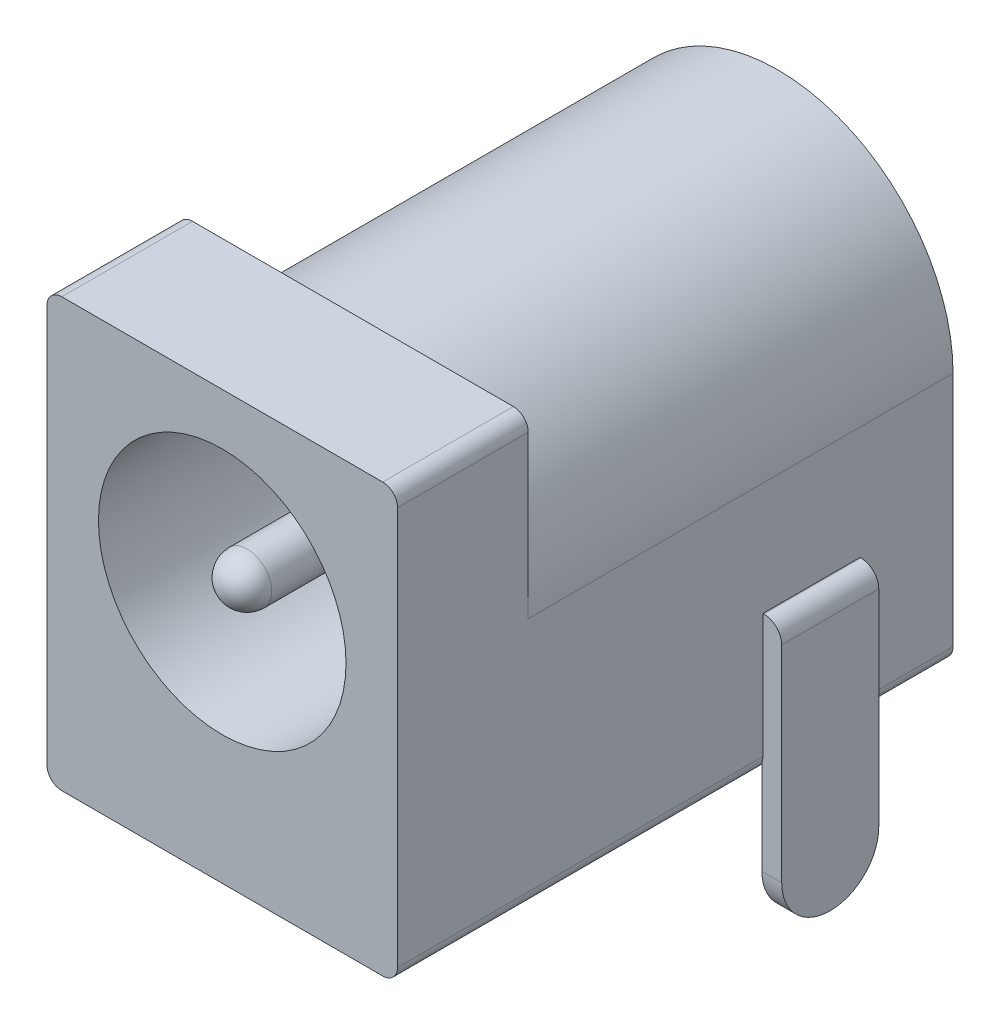
from build123d import *

# Parameters (mm, degrees)
BASE_EXTRUDE_DEPTH       = 14.2494
SKETCH2_R                = 3.175
SKETCH2_R_2              = 0.635
CUT_EXTRUDE1_DEPTH       = 11.7094
FILLET1_R                = 0.635
CUT_EXTRUDE2_DEPTH       = 10.8966
BOSS_EXTRUDE1_DEPTH      = 3.683
BOSS_EXTRUDE1_DEPTH_BACK = 3.556
SKETCH4_W                = 0.508
SKETCH4_H                = 2.4892
SKETCH4_W_2              = 2.9972
SKETCH4_H_2              = 0.508
SKETCH4_W_3              = 2.4892
SKETCH4_H_3              = 0.254
FILLET2_R                = 0.4572
CUT_EXTRUDE3_DEPTH       = 0.508
CUT_EXTRUDE4_DEPTH       = 0.508
CUT_EXTRUDE5_DEPTH       = 0.508


with BuildPart() as part:
    # Sketch1 → Base-Extrude (new body)
    with BuildSketch(Plane.XY):
        with BuildLine():
            Line((0.381, 0), (8.6106, 0))
            ThreePointArc((8.6106, 0), (8.880007684, 0.111592316), (8.9916, 0.381))
            Line((8.9916, 0.381), (8.9916, 10.5918))
            ThreePointArc((8.9916, 10.5918), (8.880007684, 10.861207684), (8.6106, 10.9728))
            Line((8.6106, 10.9728), (0.381, 10.9728))
            ThreePointArc((0.381, 10.9728), (0.111592316, 10.861207684), (0, 10.5918))
            Line((0, 10.5918), (0, 0.381))
            ThreePointArc((0, 0.381), (0.111592316, 0.111592316), (0.381, 0))
        make_face()
    extrude(amount=BASE_EXTRUDE_DEPTH)

    # Sketch2 → Cut-Extrude1 (cut)
    with BuildSketch(Plane.XY.offset(14.2494)):
        with Locations((4.4958, 6.477)):
            Circle(SKETCH2_R)
        with Locations((4.4958, 6.477)):
            Circle(SKETCH2_R_2, mode=Mode.SUBTRACT)
    extrude(amount=-CUT_EXTRUDE1_DEPTH, mode=Mode.SUBTRACT)

    # Fillet1
    fillet1_edges = [part.edges().sort_by_distance(p)[0] for p in [
        (3.8608, 6.477, 14.2494),
    ]]
    fillet(fillet1_edges, radius=FILLET1_R)

    # Sketch3 → Cut-Extrude2 (cut)
    with BuildSketch(Plane(origin=(0, 0, 0), x_dir=(-1, 0, 0), z_dir=(0, 0, -1))):
        with BuildLine():
            Line((-0.381, 10.9728), (-8.6106, 10.9728))
            ThreePointArc((-8.6106, 10.9728), (-8.880007684, 10.861207684), (-8.9916, 10.5918))
            Line((-8.9916, 10.5918), (-8.9916, 6.4516))
            ThreePointArc((-8.9916, 6.4516), (-4.4958, 10.9474), (0, 6.4516))
            Line((0, 6.4516), (0, 10.5918))
            ThreePointArc((0, 10.5918), (-0.111592316, 10.861207684), (-0.381, 10.9728))
        make_face()
    extrude(amount=-CUT_EXTRUDE2_DEPTH, mode=Mode.SUBTRACT)

    # Sketch4 → Boss-Extrude1 (add, two sides: drawn at the far end of the back side and taken through both)
    with BuildSketch(Plane.XZ.offset(-BOSS_EXTRUDE1_DEPTH_BACK)):
        with Locations((9.2202, 3.6322)):
            Rectangle(SKETCH4_W, SKETCH4_H)
        with Locations((4.4958, 0.635)):
            Rectangle(SKETCH4_W_2, SKETCH4_H_2)
        with Locations((4.4958, 6.8834)):
            Rectangle(SKETCH4_W_3, SKETCH4_H_3)
    extrude(amount=BOSS_EXTRUDE1_DEPTH + BOSS_EXTRUDE1_DEPTH_BACK)

    # Fillet2
    fillet2_edges = [part.edges().sort_by_distance(p)[0] for p in [
        (9.4742, 3.556, 3.6322),
    ]]
    fillet(fillet2_edges, radius=FILLET2_R)

    # Sketch5 → Cut-Extrude3 (cut)
    with BuildSketch(Plane(origin=(0, 0, 0.381), x_dir=(-1, 0, 0), z_dir=(0, 0, -1))):
        with BuildLine():
            Line((-2.9972, -3.683), (-5.9944, -3.683))
            Line((-5.9944, -3.683), (-5.9944, -1.9304))
            ThreePointArc((-5.9944, -1.9304), (-4.4958, -3.429), (-2.9972, -1.9304))
            Line((-2.9972, -1.9304), (-2.9972, -3.683))
        make_face()
    extrude(amount=-CUT_EXTRUDE3_DEPTH, mode=Mode.SUBTRACT)

    # Sketch6 → Cut-Extrude4 (cut)
    with BuildSketch(Plane(origin=(0.312334932, -0.354120005, 6.7564), x_dir=(-1, 0, 0), z_dir=(0, 0, -1))):
        with BuildLine():
            Line((-2.938865068, -3.328879995), (-5.428065068, -3.328879995))
            Line((-5.428065068, -3.328879995), (-5.428065068, -1.830279995))
            ThreePointArc((-5.428065068, -1.830279995), (-4.183465068, -3.074879995), (-2.938865068, -1.830279995))
            Line((-2.938865068, -1.830279995), (-2.938865068, -3.328879995))
        make_face()
    extrude(amount=-CUT_EXTRUDE4_DEPTH, mode=Mode.SUBTRACT)

    # Sketch7 → Cut-Extrude5 (cut)
    with BuildSketch(Plane(origin=(9.4742, 0, 0), x_dir=(0, 0, -1), z_dir=(1, 0, 0))):
        with BuildLine():
            Line((-2.3876, -3.683), (-2.3876, -2.1844))
            ThreePointArc((-2.3876, -2.1844), (-3.6322, -3.429), (-4.8768, -2.1844))
            Line((-4.8768, -2.1844), (-4.8768, -3.683))
            Line((-4.8768, -3.683), (-2.3876, -3.683))
        make_face()
    extrude(amount=-CUT_EXTRUDE5_DEPTH, mode=Mode.SUBTRACT)


solid = part.part
